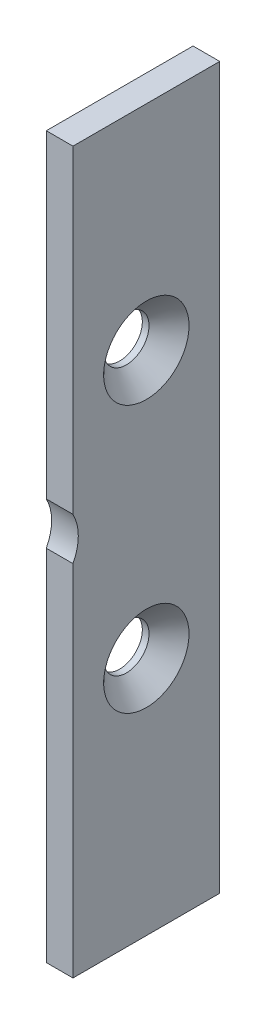
from build123d import *

# Parameters (mm, degrees)
END_STOP_SHEET_SKETCH_W                   = 2
END_STOP_SHEET_SKETCH_H                   = 54
END_STOP_SHEET_DEPTH                      = 11
SCREW_END_CLEARANCE_SKETCH_R              = 3.4
SCREW_END_CLEARANCE_DEPTH                 = 2.2
M3_COUNTERSUNK_CLEARANCE_1_BORE_PROFILE_R = 1.7
M3_COUNTERSUNK_CLEARANCE_1_BORE_DEPTH     = 2.2
M3_COUNTERSUNK_CLEARANCE_2_BORE_PROFILE_R = 1.7
M3_COUNTERSUNK_CLEARANCE_2_BORE_DEPTH     = 2.2


with BuildPart() as part:
    # End stop sheet sketch → End stop sheet (new body)
    with BuildSketch(Plane.XY.offset(-33.5)):
        with Locations((59.2, -27.5)):
            Rectangle(END_STOP_SHEET_SKETCH_W, END_STOP_SHEET_SKETCH_H)
    extrude(amount=END_STOP_SHEET_DEPTH)

    # Screw end clearance sketch → Screw end clearance (cut)
    with BuildSketch(Plane(origin=(58.1, 0, 0), x_dir=(0, 0, -1), z_dir=(1, 0, 0))):
        with Locations((19.5, -29)):
            Circle(SCREW_END_CLEARANCE_SKETCH_R)
    extrude(amount=SCREW_END_CLEARANCE_DEPTH, mode=Mode.SUBTRACT)

    # M3 countersunk clearance 1 bore profile → M3 countersunk clearance 1 bore (cut)
    with BuildSketch(Plane.ZY.offset(-60.2)):
        with Locations(Location((-28, -18.5, 0), (0, 0, 180))):
            Circle(M3_COUNTERSUNK_CLEARANCE_1_BORE_PROFILE_R)
    extrude(amount=M3_COUNTERSUNK_CLEARANCE_1_BORE_DEPTH, mode=Mode.SUBTRACT)

    # M3 countersunk clearance 1 countersink p → M3 countersunk clearance 1 countersink (revolve, cut)
    with BuildSketch(Plane.XY.offset(-28), mode=Mode.PRIVATE) as m3_countersunk_clearance_1_countersink_sk:
        Polygon((60.2, -18.5), (60.2, -15.3), (58.7, -16.8), (58.7, -18.5), align=None)
    revolve(m3_countersunk_clearance_1_countersink_sk.sketch.rotate(Axis((70.2, -18.5, -28), (-1, 0, 0)), 90), axis=Axis((70.2, -18.5, -28), (-1, 0, 0)), mode=Mode.SUBTRACT)

    # M3 countersunk clearance 2 bore profile → M3 countersunk clearance 2 bore (cut)
    with BuildSketch(Plane.ZY.offset(-60.2)):
        with Locations(Location((-28, -38.5, 0), (0, 0, 180))):
            Circle(M3_COUNTERSUNK_CLEARANCE_2_BORE_PROFILE_R)
    extrude(amount=M3_COUNTERSUNK_CLEARANCE_2_BORE_DEPTH, mode=Mode.SUBTRACT)

    # M3 countersunk clearance 2 countersink p → M3 countersunk clearance 2 countersink (revolve, cut)
    with BuildSketch(Plane.XY.offset(-28), mode=Mode.PRIVATE) as m3_countersunk_clearance_2_countersink_sk:
        Polygon((60.2, -38.5), (60.2, -35.3), (58.7, -36.8), (58.7, -38.5), align=None)
    revolve(m3_countersunk_clearance_2_countersink_sk.sketch.rotate(Axis((70.2, -38.5, -28), (-1, 0, 0)), 90), axis=Axis((70.2, -38.5, -28), (-1, 0, 0)), mode=Mode.SUBTRACT)


with BuildPart() as body_2:
    # Mirror1: mirrored copy
    add(part.part.mirror(Plane(origin=(0, 0, 0), x_dir=(0, 0, 1), z_dir=(0, -1, 0))))


solid = body_2.part
